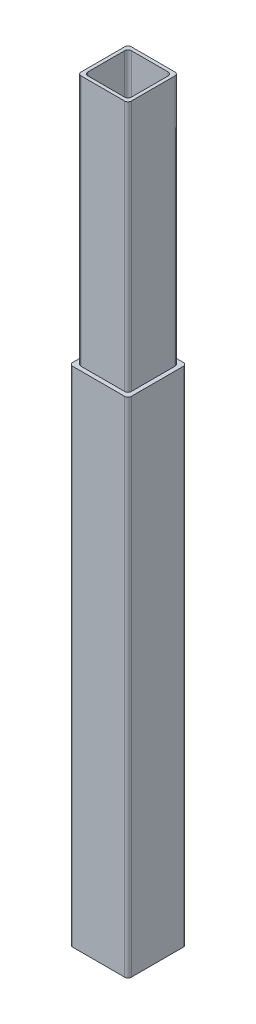
from build123d import *

# Parameters (mm, degrees)
CUSTOM_TUBE_CARRE_35_2_5_1_DEPTH = 300
CUSTOM_TUBE_CARRE_30_2_1_DEPTH   = 250


with BuildPart() as part:
    # Esquisse11 → Custom TUBE-CARRE-35-2.5(1) (new body)
    with BuildSketch(Plane(origin=(0, 0, 0), x_dir=(-1, 0, 0), z_dir=(0, 1, 0))):
        with BuildLine():
            Line((-15.5, -17.5), (15.5, -17.5))
            ThreePointArc((15.5, -17.5), (16.914213562, -16.914213562), (17.5, -15.5))
            Line((17.5, -15.5), (17.5, 15.5))
            ThreePointArc((17.5, 15.5), (16.914213562, 16.914213562), (15.5, 17.5))
            Line((15.5, 17.5), (-15.5, 17.5))
            ThreePointArc((-15.5, 17.5), (-16.914213562, 16.914213562), (-17.5, 15.5))
            Line((-17.5, 15.5), (-17.5, -15.5))
            ThreePointArc((-17.5, -15.5), (-16.914213562, -16.914213562), (-15.5, -17.5))
        make_face()
        with BuildLine():
            Line((-13, -15), (13, -15))
            ThreePointArc((13, -15), (14.414213562, -14.414213562), (15, -13))
            Line((15, -13), (15, 13))
            ThreePointArc((15, 13), (14.414213562, 14.414213562), (13, 15))
            Line((13, 15), (-13, 15))
            ThreePointArc((-13, 15), (-14.414213562, 14.414213562), (-15, 13))
            Line((-15, 13), (-15, -13))
            ThreePointArc((-15, -13), (-14.414213562, -14.414213562), (-13, -15))
        make_face(mode=Mode.SUBTRACT)
    extrude(amount=CUSTOM_TUBE_CARRE_35_2_5_1_DEPTH)


with BuildPart() as body_2:
    # Esquisse12 → Custom TUBE-CARRE-30-2(1) (new body)
    with BuildSketch(Plane(origin=(0, 200, 0), x_dir=(-1, 0, 0), z_dir=(0, 1, 0))):
        with BuildLine():
            Line((-13, -15), (13, -15))
            ThreePointArc((13, -15), (14.414213562, -14.414213562), (15, -13))
            Line((15, -13), (15, 13))
            ThreePointArc((15, 13), (14.414213562, 14.414213562), (13, 15))
            Line((13, 15), (-13, 15))
            ThreePointArc((-13, 15), (-14.414213562, 14.414213562), (-15, 13))
            Line((-15, 13), (-15, -13))
            ThreePointArc((-15, -13), (-14.414213562, -14.414213562), (-13, -15))
        make_face()
        with BuildLine():
            Line((-11, -13), (11, -13))
            ThreePointArc((11, -13), (12.414213562, -12.414213562), (13, -11))
            Line((13, -11), (13, 11))
            ThreePointArc((13, 11), (12.414213562, 12.414213562), (11, 13))
            Line((11, 13), (-11, 13))
            ThreePointArc((-11, 13), (-12.414213562, 12.414213562), (-13, 11))
            Line((-13, 11), (-13, -11))
            ThreePointArc((-13, -11), (-12.414213562, -12.414213562), (-11, -13))
        make_face(mode=Mode.SUBTRACT)
    extrude(amount=CUSTOM_TUBE_CARRE_30_2_1_DEPTH)


solid = Compound([part.part, body_2.part])
